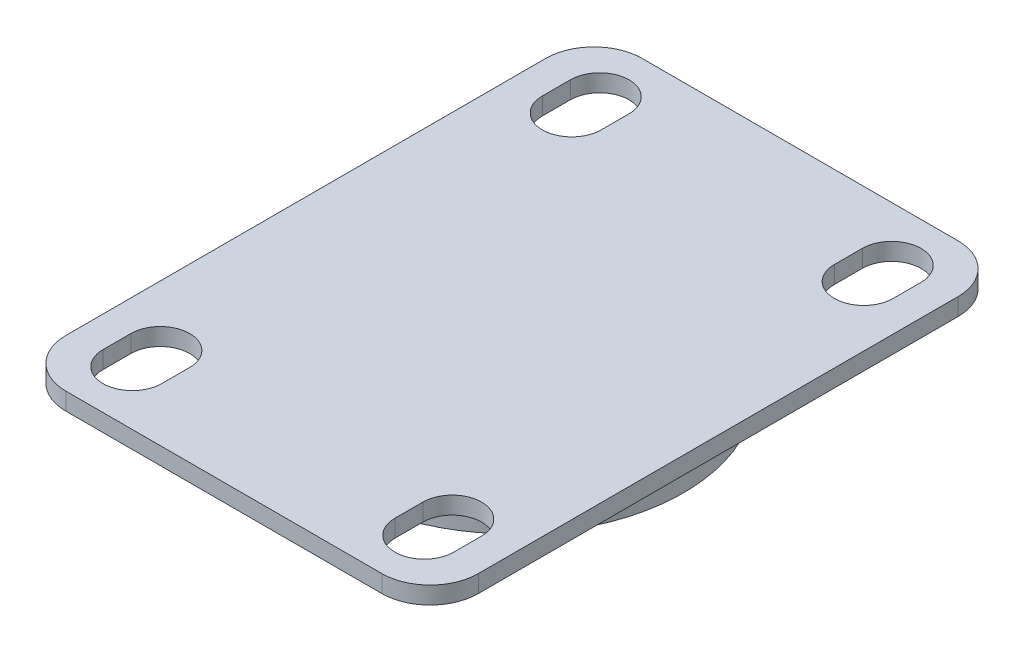
from build123d import *

# Parameters (mm, degrees)
BOSS_EXTRUDE1_DEPTH = 1.8
SKETCH3_R           = 17.8
SKETCH2_R           = 15.95
SKETCH4_R           = 17.8
BOSS_EXTRUDE2_DEPTH = 2


with BuildPart() as part:
    # Sketch1 → Boss-Extrude1 (new body)
    with BuildSketch(Plane(origin=(0, 0, 0), x_dir=(1, 0, 0), z_dir=(0, 1, 0))):
        with BuildLine():
            Line((-16.4, -29.9), (16.4, -29.9))
            ThreePointArc((16.4, -29.9), (19.935533906, -28.435533906), (21.4, -24.9))
            Line((21.4, -24.9), (21.4, 24.9))
            ThreePointArc((21.4, 24.9), (19.935533906, 28.435533906), (16.4, 29.9))
            Line((16.4, 29.9), (-16.4, 29.9))
            ThreePointArc((-16.4, 29.9), (-19.935533906, 28.435533906), (-21.4, 24.9))
            Line((-21.4, 24.9), (-21.4, -24.9))
            ThreePointArc((-21.4, -24.9), (-19.935533906, -28.435533906), (-16.4, -29.9))
        make_face()
        with BuildLine():
            Line((-12.1, 24.25), (-12.1, 21.35))
            ThreePointArc((-12.1, 21.35), (-15.15, 18.3), (-18.2, 21.35))
            Line((-18.2, 21.35), (-18.2, 24.25))
            ThreePointArc((-18.2, 24.25), (-15.15, 27.3), (-12.1, 24.25))
        make_face(mode=Mode.SUBTRACT)
        with BuildLine():
            Line((-12.1, -24.25), (-12.1, -21.35))
            ThreePointArc((-12.1, -21.35), (-15.15, -18.3), (-18.2, -21.35))
            Line((-18.2, -21.35), (-18.2, -24.25))
            ThreePointArc((-18.2, -24.25), (-15.15, -27.3), (-12.1, -24.25))
        make_face(mode=Mode.SUBTRACT)
        with BuildLine():
            Line((12.1, 24.25), (12.1, 21.35))
            ThreePointArc((12.1, 21.35), (15.15, 18.3), (18.2, 21.35))
            Line((18.2, 21.35), (18.2, 24.25))
            ThreePointArc((18.2, 24.25), (15.15, 27.3), (12.1, 24.25))
        make_face(mode=Mode.SUBTRACT)
        with BuildLine():
            Line((12.1, -24.25), (12.1, -21.35))
            ThreePointArc((12.1, -21.35), (15.15, -18.3), (18.2, -21.35))
            Line((18.2, -21.35), (18.2, -24.25))
            ThreePointArc((18.2, -24.25), (15.15, -27.3), (12.1, -24.25))
        make_face(mode=Mode.SUBTRACT)
    extrude(amount=BOSS_EXTRUDE1_DEPTH)

    # Sketch3 → Loft1 section 0
    with BuildSketch(Plane(origin=(0, -3.2, 0), x_dir=(-1, 0, 0), z_dir=(0, -1, 0))):
        Circle(SKETCH3_R)
    # Sketch2 → Loft1 section 1
    with BuildSketch(Plane.XZ):
        Circle(SKETCH2_R)
    loft()


with BuildPart() as body_2:
    # Sketch4 → Boss-Extrude2 (new body)
    with BuildSketch(Plane.XZ.offset(3.2)):
        with Locations(Location((0, 0, 0), (0, 0, 270))):
            Circle(SKETCH4_R)
    extrude(amount=BOSS_EXTRUDE2_DEPTH)


solid = Compound([part.part, body_2.part])
